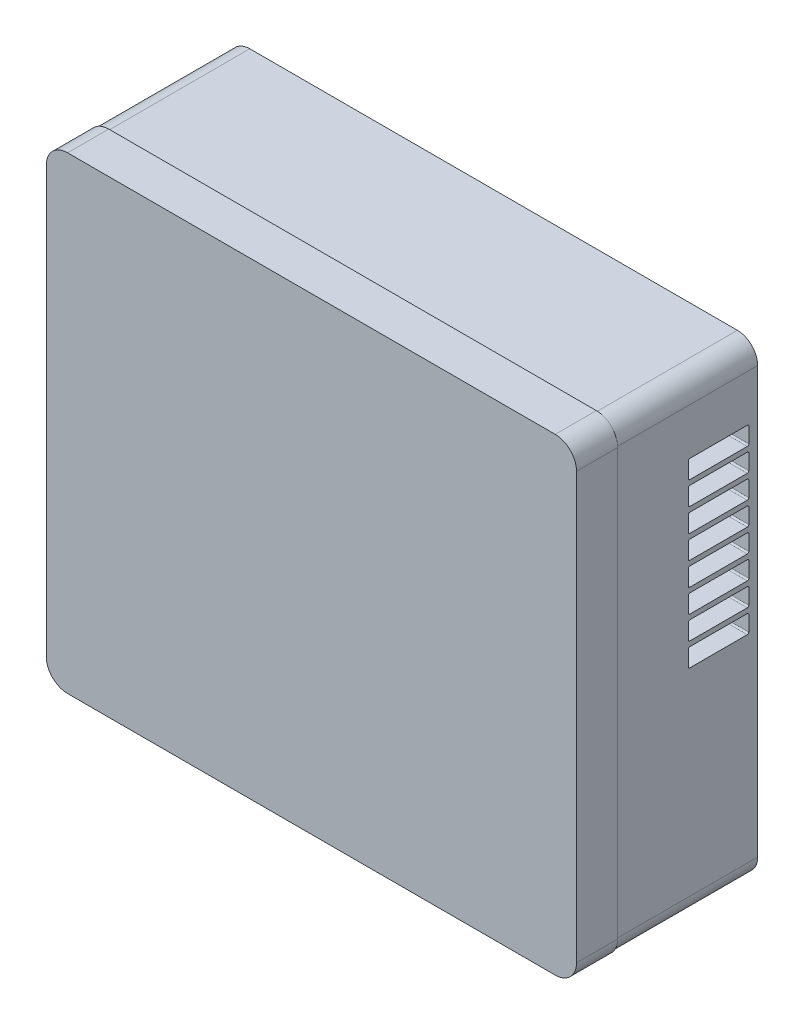
from build123d import *

# Parameters (mm, degrees)
BOSS_EXTRUDE1_DEPTH = 2
BOSS_EXTRUDE3_DEPTH = 8.3
SKETCH4_W           = 57.8
SKETCH4_H           = 38.4
BOSS_EXTRUDE5_DEPTH = 2
BOSS_EXTRUDE6_DEPTH = 28.466
SKETCH7_W           = 57.8
SKETCH7_H           = 38.4
CUT_EXTRUDE1_DEPTH  = 2
SKETCH9_W           = 8.74
SKETCH9_H           = 13.649992795
SKETCH9_W_2         = 2
SKETCH9_W_3         = 1.707
SKETCH9_W_4         = 9.3
SKETCH9_H_2         = 11
SKETCH9_W_5         = 17.696
SKETCH9_H_3         = 6.81
SKETCH9_W_6         = 14.05
SKETCH9_H_4         = 16.84
SKETCH9_W_7         = 8.89
SKETCH9_H_5         = 3.43
CUT_EXTRUDE2_DEPTH  = 2
CUT_EXTRUDE3_DEPTH  = 2
CUT_EXTRUDE4_DEPTH  = 2
CUT_EXTRUDE5_DEPTH  = 2
CUT_EXTRUDE7_DEPTH  = 2
CUT_EXTRUDE8_DEPTH  = 25


with BuildPart() as part:
    # Sketch2 → Boss-Extrude1 (new body)
    with BuildSketch(Plane.XY):
        with BuildLine():
            Line((-86.3, 47.45), (-86.3, -38.45))
            ThreePointArc((-86.3, -38.45), (-85.626345597, -40.076345597), (-84, -40.75))
            Line((-84, -40.75), (14.4, -40.75))
            ThreePointArc((14.4, -40.75), (16.026345597, -40.076345597), (16.7, -38.45))
            Line((16.7, -38.45), (16.7, 47.45))
            ThreePointArc((16.7, 47.45), (16.026345597, 49.076345597), (14.4, 49.75))
            Line((14.4, 49.75), (-84, 49.75))
            ThreePointArc((-84, 49.75), (-85.626345597, 49.076345597), (-86.3, 47.45))
        make_face()
    extrude(amount=BOSS_EXTRUDE1_DEPTH)

    # Sketch3 → Boss-Extrude3 (add)
    with BuildSketch(Plane.XY.offset(2)):
        with BuildLine():
            Line((-88.3, 47.45), (-88.3, -38.45))
            ThreePointArc((-88.3, -38.45), (-87.040559159, -41.490559159), (-84, -42.75))
            Line((-84, -42.75), (14.4, -42.75))
            ThreePointArc((14.4, -42.75), (17.440559159, -41.490559159), (18.7, -38.45))
            Line((18.7, -38.45), (18.7, 47.45))
            ThreePointArc((18.7, 47.45), (17.440559159, 50.490559159), (14.4, 51.75))
            Line((14.4, 51.75), (-84, 51.75))
            ThreePointArc((-84, 51.75), (-87.040559159, 50.490559159), (-88.3, 47.45))
        make_face()
    extrude(amount=-BOSS_EXTRUDE3_DEPTH)



with BuildPart() as body_2:
    # Sketch4 → Boss-Extrude5 (new body)
    with BuildSketch(Plane(origin=(0, 0, -34.766), x_dir=(-1, 0, 0), z_dir=(0, 0, -1))):
        with BuildLine():
            Line((-14.4, -40.55), (84, -40.55))
            ThreePointArc((84, -40.55), (85.48492424, -39.93492424), (86.1, -38.45))
            Line((86.1, -38.45), (86.1, 47.45))
            ThreePointArc((86.1, 47.45), (85.48492424, 48.93492424), (84, 49.55))
            Line((84, 49.55), (-14.4, 49.55))
            ThreePointArc((-14.4, 49.55), (-15.88492424, 48.93492424), (-16.5, 47.45))
            Line((-16.5, 47.45), (-16.5, -38.45))
            ThreePointArc((-16.5, -38.45), (-15.88492424, -39.93492424), (-14.4, -40.55))
        make_face()
        with Locations((32.8, 19.76)):
            Rectangle(SKETCH4_W, SKETCH4_H, mode=Mode.SUBTRACT)
    extrude(amount=-BOSS_EXTRUDE5_DEPTH)


with BuildPart() as part_1:
    add(part.part)

    add(body_2.part)  # Boss-Extrude6 merges body 2
    # Sketch6 → Boss-Extrude6 (add)
    with BuildSketch(Plane(origin=(0, 0, -34.766), x_dir=(-1, 0, 0), z_dir=(0, 0, -1))):
        with BuildLine():
            Line((-14.4, -42.55), (84, -42.55))
            ThreePointArc((84, -42.55), (86.899137803, -41.349137803), (88.1, -38.45))
            Line((88.1, -38.45), (88.1, 47.45))
            ThreePointArc((88.1, 47.45), (86.899137803, 50.349137803), (84, 51.55))
            Line((84, 51.55), (-14.4, 51.55))
            ThreePointArc((-14.4, 51.55), (-17.299137803, 50.349137803), (-18.5, 47.45))
            Line((-18.5, 47.45), (-18.5, -38.45))
            ThreePointArc((-18.5, -38.45), (-17.299137803, -41.349137803), (-14.4, -42.55))
        make_face()
    extrude(amount=-BOSS_EXTRUDE6_DEPTH)

    # Sketch7 → Cut-Extrude1 (cut)
    with BuildSketch(Plane(origin=(0, 0, -34.766), x_dir=(-1, 0, 0), z_dir=(0, 0, -1))):
        with Locations((32.8, 19.76)):
            Rectangle(SKETCH7_W, SKETCH7_H)
    extrude(amount=-CUT_EXTRUDE1_DEPTH, mode=Mode.SUBTRACT)

    # Sketch9 → Cut-Extrude2 (cut)
    with BuildSketch(Plane.XZ.offset(42.55)):
        with Locations((-61.75, -13.294996398)):
            Rectangle(SKETCH9_W, SKETCH9_H)
        with Locations((-56.38, -13.294996398)):
            Rectangle(SKETCH9_W_2, SKETCH9_H)
        with Locations((-67.12, -13.294996398)):
            Rectangle(SKETCH9_W_2, SKETCH9_H)
        with Locations((-54.5265, -13.294996398)):
            Rectangle(SKETCH9_W_3, SKETCH9_H)
        with Locations((-68.9735, -13.294996398)):
            Rectangle(SKETCH9_W_3, SKETCH9_H)
        with Locations((9.2, -11.97)):
            Rectangle(SKETCH9_W_4, SKETCH9_H_2)
        with Locations((-7.56, -9.9512)):
            Rectangle(SKETCH9_W_5, SKETCH9_H_3)
        with Locations((-27.4, -14.9662)):
            Rectangle(SKETCH9_W_6, SKETCH9_H_4)
        with Locations((-44.4, -14.9662)):
            Rectangle(SKETCH9_W_6, SKETCH9_H_4)
        with Locations((-76.775, -8.2612)):
            Rectangle(SKETCH9_W_7, SKETCH9_H_5)
    extrude(amount=-CUT_EXTRUDE2_DEPTH, mode=Mode.SUBTRACT)

    # Sketch13 → Cut-Extrude3 (cut)
    with BuildSketch(Plane(origin=(18.5, 0, 0), x_dir=(0, 0, -1), z_dir=(1, 0, 0))):
        with BuildLine():
            Line((32.966, 1.76), (32.966, 4.86))
            ThreePointArc((32.966, 4.86), (32.878132034, 5.072132034), (32.666, 5.16))
            Line((32.666, 5.16), (21.066, 5.16))
            ThreePointArc((21.066, 5.16), (20.853867966, 5.072132034), (20.766, 4.86))
            Line((20.766, 4.86), (20.766, 1.76))
            ThreePointArc((20.766, 1.76), (20.853867966, 1.547867966), (21.066, 1.46))
            Line((21.066, 1.46), (32.666, 1.46))
            ThreePointArc((32.666, 1.46), (32.878132034, 1.547867966), (32.966, 1.76))
        make_face()
    extrude(amount=-CUT_EXTRUDE3_DEPTH, mode=Mode.SUBTRACT)

    # Sketch14 → Cut-Extrude4 (cut)
    with BuildSketch(Plane(origin=(-3.9, 0, 0), x_dir=(0, 0, -1), z_dir=(1, 0, 0))):
        with BuildLine():
            Line((32.966, 34.66), (32.966, 37.76))
            ThreePointArc((32.966, 37.76), (32.878132034, 37.972132034), (32.666, 38.06))
            Line((32.666, 38.06), (21.066, 38.06))
            ThreePointArc((21.066, 38.06), (20.853867966, 37.972132034), (20.766, 37.76))
            Line((20.766, 37.76), (20.766, 34.66))
            ThreePointArc((20.766, 34.66), (20.853867966, 34.447867966), (21.066, 34.36))
            Line((21.066, 34.36), (32.666, 34.36))
            ThreePointArc((32.666, 34.36), (32.878132034, 34.447867966), (32.966, 34.66))
        make_face()
        with BuildLine():
            Line((20.766, 33.06), (20.766, 29.96))
            ThreePointArc((20.766, 29.96), (20.853867966, 29.747867966), (21.066, 29.66))
            Line((21.066, 29.66), (32.666, 29.66))
            ThreePointArc((32.666, 29.66), (32.878132034, 29.747867966), (32.966, 29.96))
            Line((32.966, 29.96), (32.966, 33.06))
            ThreePointArc((32.966, 33.06), (32.878132034, 33.272132034), (32.666, 33.36))
            Line((32.666, 33.36), (21.066, 33.36))
            ThreePointArc((21.066, 33.36), (20.853867966, 33.272132034), (20.766, 33.06))
        make_face()
        with BuildLine():
            Line((32.666, 28.66), (21.066, 28.66))
            ThreePointArc((21.066, 28.66), (20.853867966, 28.572132034), (20.766, 28.36))
            Line((20.766, 28.36), (20.766, 25.26))
            ThreePointArc((20.766, 25.26), (20.853867966, 25.047867966), (21.066, 24.96))
            Line((21.066, 24.96), (32.666, 24.96))
            ThreePointArc((32.666, 24.96), (32.878132034, 25.047867966), (32.966, 25.26))
            Line((32.966, 25.26), (32.966, 28.36))
            ThreePointArc((32.966, 28.36), (32.878132034, 28.572132034), (32.666, 28.66))
        make_face()
        with BuildLine():
            Line((32.666, 23.96), (21.066, 23.96))
            ThreePointArc((21.066, 23.96), (20.853867966, 23.872132034), (20.766, 23.66))
            Line((20.766, 23.66), (20.766, 20.56))
            ThreePointArc((20.766, 20.56), (20.853867966, 20.347867966), (21.066, 20.26))
            Line((21.066, 20.26), (32.666, 20.26))
            ThreePointArc((32.666, 20.26), (32.878132034, 20.347867966), (32.966, 20.56))
            Line((32.966, 20.56), (32.966, 23.66))
            ThreePointArc((32.966, 23.66), (32.878132034, 23.872132034), (32.666, 23.96))
        make_face()
        with BuildLine():
            Line((32.666, 19.26), (21.066, 19.26))
            ThreePointArc((21.066, 19.26), (20.853867966, 19.172132034), (20.766, 18.96))
            Line((20.766, 18.96), (20.766, 15.86))
            ThreePointArc((20.766, 15.86), (20.853867966, 15.647867966), (21.066, 15.56))
            Line((21.066, 15.56), (32.666, 15.56))
            ThreePointArc((32.666, 15.56), (32.878132034, 15.647867966), (32.966, 15.86))
            Line((32.966, 15.86), (32.966, 18.96))
            ThreePointArc((32.966, 18.96), (32.878132034, 19.172132034), (32.666, 19.26))
        make_face()
        with BuildLine():
            Line((32.666, 14.56), (21.066, 14.56))
            ThreePointArc((21.066, 14.56), (20.853867966, 14.472132034), (20.766, 14.26))
            Line((20.766, 14.26), (20.766, 11.16))
            ThreePointArc((20.766, 11.16), (20.853867966, 10.947867966), (21.066, 10.86))
            Line((21.066, 10.86), (32.666, 10.86))
            ThreePointArc((32.666, 10.86), (32.878132034, 10.947867966), (32.966, 11.16))
            Line((32.966, 11.16), (32.966, 14.26))
            ThreePointArc((32.966, 14.26), (32.878132034, 14.472132034), (32.666, 14.56))
        make_face()
        with BuildLine():
            Line((20.766, 9.56), (20.766, 6.46))
            ThreePointArc((20.766, 6.46), (20.853867966, 6.247867966), (21.066, 6.16))
            Line((21.066, 6.16), (32.666, 6.16))
            ThreePointArc((32.666, 6.16), (32.878132034, 6.247867966), (32.966, 6.46))
            Line((32.966, 6.46), (32.966, 9.56))
            ThreePointArc((32.966, 9.56), (32.878132034, 9.772132034), (32.666, 9.86))
            Line((32.666, 9.86), (21.066, 9.86))
            ThreePointArc((21.066, 9.86), (20.853867966, 9.772132034), (20.766, 9.56))
        make_face()
    extrude(amount=-CUT_EXTRUDE4_DEPTH, mode=Mode.SUBTRACT)

    # Sketch15 → Cut-Extrude5 (cut)
    with BuildSketch(Plane(origin=(18.5, 0, 0), x_dir=(0, 0, -1), z_dir=(1, 0, 0))):
        with BuildLine():
            Line((20.766, 9.56), (20.766, 6.46))
            ThreePointArc((20.766, 6.46), (20.853867966, 6.247867966), (21.066, 6.16))
            Line((21.066, 6.16), (32.666, 6.16))
            ThreePointArc((32.666, 6.16), (32.878132034, 6.247867966), (32.966, 6.46))
            Line((32.966, 6.46), (32.966, 9.56))
            ThreePointArc((32.966, 9.56), (32.878132034, 9.772132034), (32.666, 9.86))
            Line((32.666, 9.86), (21.066, 9.86))
            ThreePointArc((21.066, 9.86), (20.853867966, 9.772132034), (20.766, 9.56))
        make_face()
    extrude(amount=-CUT_EXTRUDE5_DEPTH, mode=Mode.SUBTRACT)

    # Sketch16 → Cut-Extrude7 (cut)
    with BuildSketch(Plane(origin=(18.5, 0, 0), x_dir=(0, 0, -1), z_dir=(1, 0, 0))):
        with BuildLine():
            Line((21.066, 34.36), (32.666, 34.36))
            ThreePointArc((32.666, 34.36), (32.878132034, 34.447867966), (32.966, 34.66))
            Line((32.966, 34.66), (32.966, 37.76))
            ThreePointArc((32.966, 37.76), (32.878132034, 37.972132034), (32.666, 38.06))
            Line((32.666, 38.06), (21.066, 38.06))
            ThreePointArc((21.066, 38.06), (20.853867966, 37.972132034), (20.766, 37.76))
            Line((20.766, 37.76), (20.766, 34.66))
            ThreePointArc((20.766, 34.66), (20.853867966, 34.447867966), (21.066, 34.36))
        make_face()
        with BuildLine():
            Line((21.066, 29.66), (32.666, 29.66))
            ThreePointArc((32.666, 29.66), (32.878132034, 29.747867966), (32.966, 29.96))
            Line((32.966, 29.96), (32.966, 33.06))
            ThreePointArc((32.966, 33.06), (32.878132034, 33.272132034), (32.666, 33.36))
            Line((32.666, 33.36), (21.066, 33.36))
            ThreePointArc((21.066, 33.36), (20.853867966, 33.272132034), (20.766, 33.06))
            Line((20.766, 33.06), (20.766, 29.96))
            ThreePointArc((20.766, 29.96), (20.853867966, 29.747867966), (21.066, 29.66))
        make_face()
        with BuildLine():
            Line((32.666, 24.96), (21.066, 24.96))
            ThreePointArc((21.066, 24.96), (20.853867966, 25.047867966), (20.766, 25.26))
            Line((20.766, 25.26), (20.766, 28.36))
            ThreePointArc((20.766, 28.36), (20.853867966, 28.572132034), (21.066, 28.66))
            Line((21.066, 28.66), (32.666, 28.66))
            ThreePointArc((32.666, 28.66), (32.878132034, 28.572132034), (32.966, 28.36))
            Line((32.966, 28.36), (32.966, 25.26))
            ThreePointArc((32.966, 25.26), (32.878132034, 25.047867966), (32.666, 24.96))
        make_face()
        with BuildLine():
            Line((20.766, 20.56), (20.766, 23.66))
            ThreePointArc((20.766, 23.66), (20.853867966, 23.872132034), (21.066, 23.96))
            Line((21.066, 23.96), (32.666, 23.96))
            ThreePointArc((32.666, 23.96), (32.878132034, 23.872132034), (32.966, 23.66))
            Line((32.966, 23.66), (32.966, 20.56))
            ThreePointArc((32.966, 20.56), (32.878132034, 20.347867966), (32.666, 20.26))
            Line((32.666, 20.26), (21.066, 20.26))
            ThreePointArc((21.066, 20.26), (20.853867966, 20.347867966), (20.766, 20.56))
        make_face()
        with BuildLine():
            Line((32.966, 15.86), (32.966, 18.96))
            ThreePointArc((32.966, 18.96), (32.878132034, 19.172132034), (32.666, 19.26))
            Line((32.666, 19.26), (21.066, 19.26))
            ThreePointArc((21.066, 19.26), (20.853867966, 19.172132034), (20.766, 18.96))
            Line((20.766, 18.96), (20.766, 15.86))
            ThreePointArc((20.766, 15.86), (20.853867966, 15.647867966), (21.066, 15.56))
            Line((21.066, 15.56), (32.666, 15.56))
            ThreePointArc((32.666, 15.56), (32.878132034, 15.647867966), (32.966, 15.86))
        make_face()
        with BuildLine():
            Line((32.666, 14.56), (21.066, 14.56))
            ThreePointArc((21.066, 14.56), (20.853867966, 14.472132034), (20.766, 14.26))
            Line((20.766, 14.26), (20.766, 11.16))
            ThreePointArc((20.766, 11.16), (20.853867966, 10.947867966), (21.066, 10.86))
            Line((21.066, 10.86), (32.666, 10.86))
            ThreePointArc((32.666, 10.86), (32.878132034, 10.947867966), (32.966, 11.16))
            Line((32.966, 11.16), (32.966, 14.26))
            ThreePointArc((32.966, 14.26), (32.878132034, 14.472132034), (32.666, 14.56))
        make_face()
    extrude(amount=-CUT_EXTRUDE7_DEPTH, mode=Mode.SUBTRACT)

    # Sketch17 → Cut-Extrude8 (cut)
    with BuildSketch(Plane(origin=(16.5, 0, 0), x_dir=(0, 0, -1), z_dir=(1, 0, 0))):
        with BuildLine():
            Line((21.066, 34.36), (32.666, 34.36))
            ThreePointArc((32.666, 34.36), (32.878132034, 34.447867966), (32.966, 34.66))
            Line((32.966, 34.66), (32.966, 37.76))
            ThreePointArc((32.966, 37.76), (32.878132034, 37.972132034), (32.666, 38.06))
            Line((32.666, 38.06), (21.066, 38.06))
            ThreePointArc((21.066, 38.06), (20.853867966, 37.972132034), (20.766, 37.76))
            Line((20.766, 37.76), (20.766, 34.66))
            ThreePointArc((20.766, 34.66), (20.853867966, 34.447867966), (21.066, 34.36))
        make_face()
        with BuildLine():
            Line((21.066, 29.66), (32.666, 29.66))
            ThreePointArc((32.666, 29.66), (32.878132034, 29.747867966), (32.966, 29.96))
            Line((32.966, 29.96), (32.966, 33.06))
            ThreePointArc((32.966, 33.06), (32.878132034, 33.272132034), (32.666, 33.36))
            Line((32.666, 33.36), (21.066, 33.36))
            ThreePointArc((21.066, 33.36), (20.853867966, 33.272132034), (20.766, 33.06))
            Line((20.766, 33.06), (20.766, 29.96))
            ThreePointArc((20.766, 29.96), (20.853867966, 29.747867966), (21.066, 29.66))
        make_face()
        with BuildLine():
            Line((21.066, 24.96), (32.666, 24.96))
            ThreePointArc((32.666, 24.96), (32.878132034, 25.047867966), (32.966, 25.26))
            Line((32.966, 25.26), (32.966, 28.36))
            ThreePointArc((32.966, 28.36), (32.878132034, 28.572132034), (32.666, 28.66))
            Line((32.666, 28.66), (21.066, 28.66))
            ThreePointArc((21.066, 28.66), (20.853867966, 28.572132034), (20.766, 28.36))
            Line((20.766, 28.36), (20.766, 25.26))
            ThreePointArc((20.766, 25.26), (20.853867966, 25.047867966), (21.066, 24.96))
        make_face()
        with BuildLine():
            Line((20.766, 23.66), (20.766, 20.56))
            ThreePointArc((20.766, 20.56), (20.853867966, 20.347867966), (21.066, 20.26))
            Line((21.066, 20.26), (32.666, 20.26))
            ThreePointArc((32.666, 20.26), (32.878132034, 20.347867966), (32.966, 20.56))
            Line((32.966, 20.56), (32.966, 23.66))
            ThreePointArc((32.966, 23.66), (32.878132034, 23.872132034), (32.666, 23.96))
            Line((32.666, 23.96), (21.066, 23.96))
            ThreePointArc((21.066, 23.96), (20.853867966, 23.872132034), (20.766, 23.66))
        make_face()
        with BuildLine():
            Line((32.966, 15.86), (32.966, 18.96))
            ThreePointArc((32.966, 18.96), (32.878132034, 19.172132034), (32.666, 19.26))
            Line((32.666, 19.26), (21.066, 19.26))
            ThreePointArc((21.066, 19.26), (20.853867966, 19.172132034), (20.766, 18.96))
            Line((20.766, 18.96), (20.766, 15.86))
            ThreePointArc((20.766, 15.86), (20.853867966, 15.647867966), (21.066, 15.56))
            Line((21.066, 15.56), (32.666, 15.56))
            ThreePointArc((32.666, 15.56), (32.878132034, 15.647867966), (32.966, 15.86))
        make_face()
        with BuildLine():
            Line((32.666, 14.56), (21.066, 14.56))
            ThreePointArc((21.066, 14.56), (20.853867966, 14.472132034), (20.766, 14.26))
            Line((20.766, 14.26), (20.766, 11.16))
            ThreePointArc((20.766, 11.16), (20.853867966, 10.947867966), (21.066, 10.86))
            Line((21.066, 10.86), (32.666, 10.86))
            ThreePointArc((32.666, 10.86), (32.878132034, 10.947867966), (32.966, 11.16))
            Line((32.966, 11.16), (32.966, 14.26))
            ThreePointArc((32.966, 14.26), (32.878132034, 14.472132034), (32.666, 14.56))
        make_face()
        with BuildLine():
            Line((20.766, 9.56), (20.766, 6.46))
            ThreePointArc((20.766, 6.46), (20.853867966, 6.247867966), (21.066, 6.16))
            Line((21.066, 6.16), (32.666, 6.16))
            ThreePointArc((32.666, 6.16), (32.878132034, 6.247867966), (32.966, 6.46))
            Line((32.966, 6.46), (32.966, 9.56))
            ThreePointArc((32.966, 9.56), (32.878132034, 9.772132034), (32.666, 9.86))
            Line((32.666, 9.86), (21.066, 9.86))
            ThreePointArc((21.066, 9.86), (20.853867966, 9.772132034), (20.766, 9.56))
        make_face()
        with BuildLine():
            Line((32.666, 5.16), (21.066, 5.16))
            ThreePointArc((21.066, 5.16), (20.853867966, 5.072132034), (20.766, 4.86))
            Line((20.766, 4.86), (20.766, 1.76))
            ThreePointArc((20.766, 1.76), (20.853867966, 1.547867966), (21.066, 1.46))
            Line((21.066, 1.46), (32.666, 1.46))
            ThreePointArc((32.666, 1.46), (32.878132034, 1.547867966), (32.966, 1.76))
            Line((32.966, 1.76), (32.966, 4.86))
            ThreePointArc((32.966, 4.86), (32.878132034, 5.072132034), (32.666, 5.16))
        make_face()
    extrude(amount=-CUT_EXTRUDE8_DEPTH, mode=Mode.SUBTRACT)


solid = part_1.part
